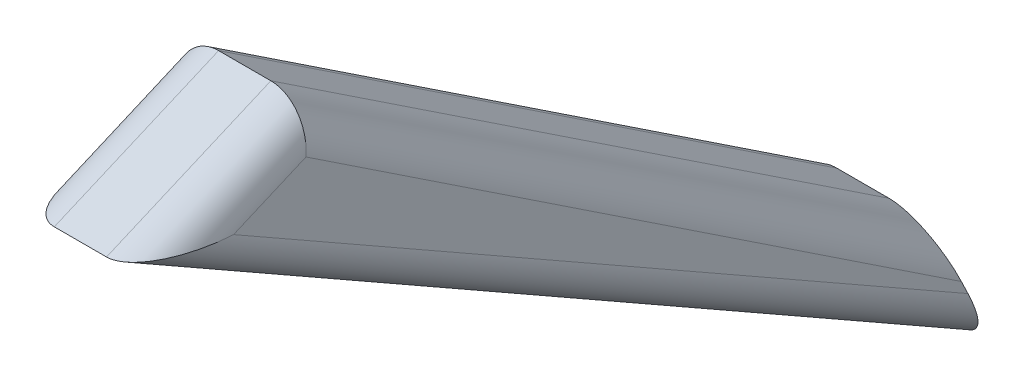
from build123d import *

# Parameters (mm, degrees)
BOSS_EXTRUDE1_DEPTH = 0.5
FILLET1_R           = 0.15


with BuildPart() as part:
    # Sketch1 → Boss-Extrude1 (new body)
    with BuildSketch(Plane(origin=(0, 0, 0), x_dir=(0, 0, -1), z_dir=(1, 0, 0))):
        Polygon((0, 0), (0.629095992, 0.269645832), (2.995585653, -1.303083755), (3.26181574, -1.857729769), align=None)
    extrude(amount=BOSS_EXTRUDE1_DEPTH)

    # Fillet1
    fillet1_edges = [part.edges().sort_by_distance(p)[0] for p in [
        (0.5, -0.516718961, -1.812340822),
        (0.5, 0.134822916, -0.314547996),
        (0.5, -0.928864885, -1.63090787),
        (0, 0.134822916, -0.314547996),
        (0, -0.516718961, -1.812340822),
        (0, -0.928864885, -1.63090787),
    ]]
    fillet(fillet1_edges, radius=FILLET1_R)


solid = part.part
